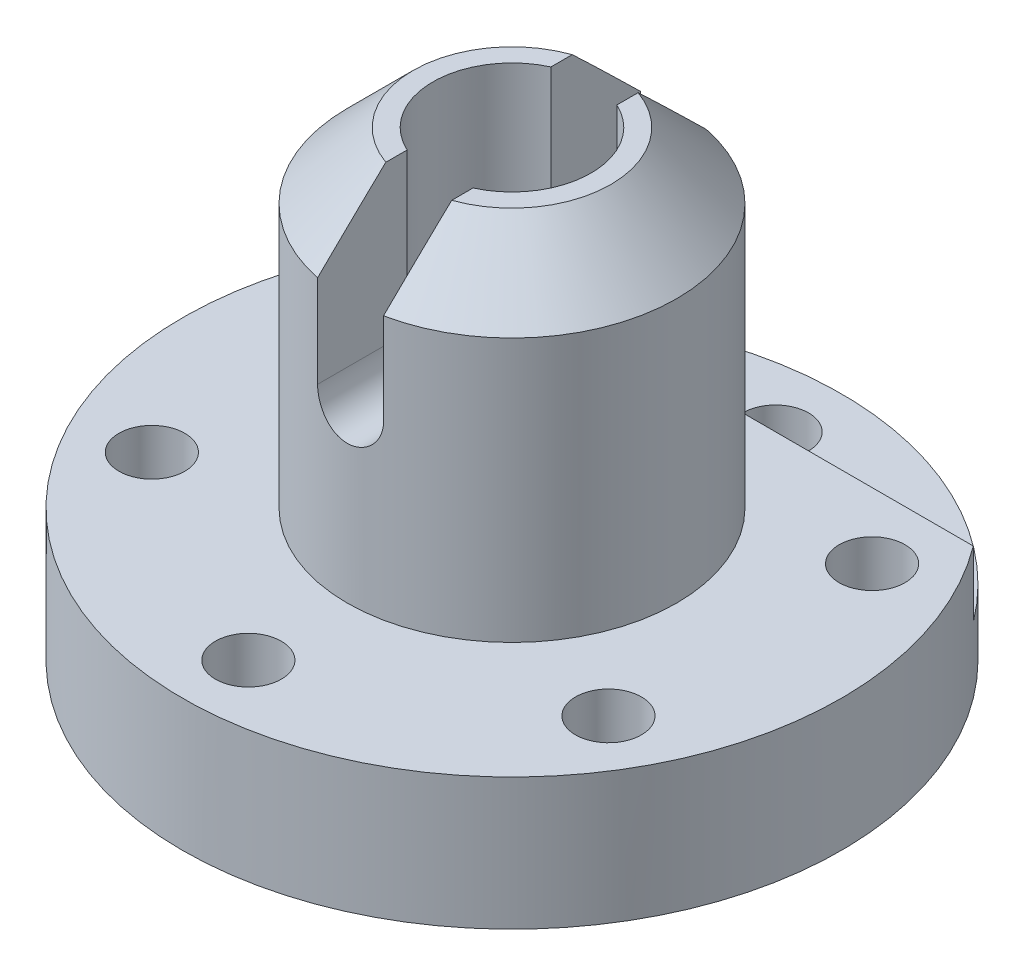
from build123d import *

# Parameters (mm, degrees)
SKETCH1_R               = 25
BOSS_EXTRUDE1_DEPTH     = 10
SKETCH1_3_R             = 12.5
SKETCH1_3_R_2           = 6
BOSS_EXTRUDE2_DEPTH     = 35
CUT_EXTRUDE1_START      = 5
CUT_EXTRUDE1_DEPTH      = 5
CUT_EXTRUDE2_DEPTH      = 50.749371855
CUT_EXTRUDE2_DEPTH_BACK = 50.749371855
SKETCH3_R               = 2.5
CUT_EXTRUDE3_DEPTH      = 50.749371926
CIRPATTERN1_COUNT       = 6
CHAMFER1_SIZE           = 5


with BuildPart() as part:
    # Sketch1 → Boss-Extrude1 (new body)
    with BuildSketch(Plane(origin=(0, 0, 0), x_dir=(1, 0, 0), z_dir=(0, 1, 0))):
        with Locations(Location((0, 0, 0), (0, 0, 270))):
            Circle(SKETCH1_R)
    extrude(amount=BOSS_EXTRUDE1_DEPTH)

    # Sketch1<3> → Boss-Extrude2 (add)
    with BuildSketch(Plane(origin=(0, 0, 0), x_dir=(1, 0, 0), z_dir=(0, 1, 0))):
        with Locations(Location((0, 0, 0), (0, 0, 270))):
            Circle(SKETCH1_3_R)
        with Locations(Location((0, 0, 0), (0, 0, 270))):
            Circle(SKETCH1_3_R_2, mode=Mode.SUBTRACT)
    extrude(amount=BOSS_EXTRUDE2_DEPTH)

    # Sketch1<5> → Cut-Extrude1 (cut)
    with BuildSketch(Plane(origin=(0, 0, 0), x_dir=(1, 0, 0), z_dir=(0, 1, 0)).offset(CUT_EXTRUDE1_START)):
        with BuildLine():
            ThreePointArc((20, 15), (0, 25), (-20, 15))
            Line((-20, 15), (20, 15))
        make_face()
    extrude(amount=CUT_EXTRUDE1_DEPTH, mode=Mode.SUBTRACT)

    # Sketch2 → Cut-Extrude2 (cut, two sides: drawn at the far end of the back side and taken through both)
    with BuildSketch(Plane.XY.offset(-CUT_EXTRUDE2_DEPTH_BACK)):
        with BuildLine():
            Line((0, 25.5), (0, 35))
            Line((0, 35), (-2.5, 35))
            Line((-2.5, 35), (-2.5, 23))
            ThreePointArc((-2.5, 23), (-1.767766953, 24.767766953), (0, 25.5))
        make_face()
        with BuildLine():
            Line((2.5, 35), (0, 35))
            Line((0, 35), (0, 25.5))
            ThreePointArc((0, 25.5), (1.767766953, 24.767766953), (2.5, 23))
            Line((2.5, 23), (2.5, 35))
        make_face()
        with BuildLine():
            ThreePointArc((2.5, 23), (1.767766953, 24.767766953), (0, 25.5))
            Line((0, 25.5), (0, 23))
            Line((0, 23), (2.5, 23))
        make_face()
        with BuildLine():
            Line((0, 23), (0, 25.5))
            ThreePointArc((0, 25.5), (-1.767766953, 24.767766953), (-2.5, 23))
            Line((-2.5, 23), (0, 23))
        make_face()
        with BuildLine():
            Line((2.5, 23), (0, 23))
            Line((0, 23), (0, 20.5))
            ThreePointArc((0, 20.5), (1.767766953, 21.232233047), (2.5, 23))
        make_face()
        with BuildLine():
            Line((0, 20.5), (0, 23))
            Line((0, 23), (-2.5, 23))
            ThreePointArc((-2.5, 23), (-1.767766953, 21.232233047), (0, 20.5))
        make_face()
    extrude(amount=CUT_EXTRUDE2_DEPTH + CUT_EXTRUDE2_DEPTH_BACK, mode=Mode.SUBTRACT)

    # Sketch3 → Cut-Extrude3 (cut, through all)
    with BuildSketch(Plane(origin=(0, 0, 0), x_dir=(1, 0, 0), z_dir=(0, 1, 0))):
        with Locations(Location((0, 20, 0), (0, 0, 270))):
            Circle(SKETCH3_R)
    cut_extrude3 = extrude(amount=CUT_EXTRUDE3_DEPTH, mode=Mode.SUBTRACT)

    # CirPattern1: Cut-Extrude3 ×6 about axis
    cirpattern1_axis = Axis((0, 0, 0), (0, 1, 0))
    for i in range(1, CIRPATTERN1_COUNT):
        add(cut_extrude3.rotate(cirpattern1_axis, i * 360 / CIRPATTERN1_COUNT), mode=Mode.SUBTRACT)

    # Chamfer1
    chamfer1_edges = [part.edges().sort_by_distance(p)[0] for p in [
        (-12.5, 35, 0),
        (12.5, 35, 0),
    ]]
    chamfer(chamfer1_edges, length=CHAMFER1_SIZE)


solid = part.part
